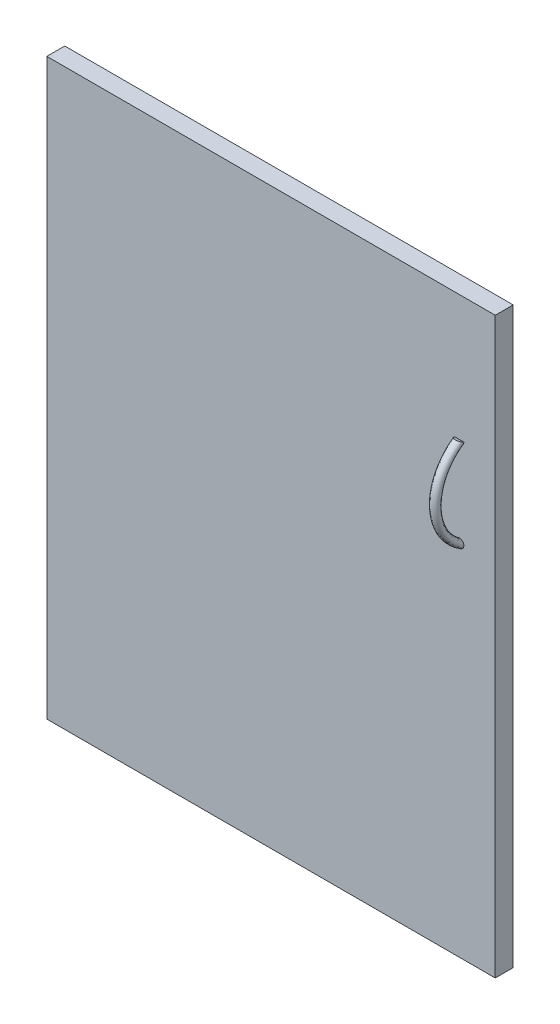
from build123d import *

# Parameters (mm, degrees)
SKETCH_1_W      = 25
SKETCH_1_H      = 32
EXTRUDE_1_DEPTH = 1
SKETCH_3_R      = 0.25


with BuildPart() as part:
    # 草圖1 → 填料-伸長1 (new body)
    with BuildSketch(Plane.XY):
        Rectangle(SKETCH_1_W, SKETCH_1_H)
    extrude(amount=EXTRUDE_1_DEPTH)

    # 掃出1: sweep along a path in 草圖4
    with BuildLine(Plane(origin=(10.5, 0, 0), x_dir=(0, 0, -1), z_dir=(1, 0, 0))) as sweep_1_path:
        ThreePointArc((-1, 4), (-2.341687605, 6.5), (-1, 9))
    # 草圖3 → 掃出1 (sweep)
    with BuildSketch(Plane.XY.offset(1)):
        with Locations((10.5, 4)):
            Circle(SKETCH_3_R)
    sweep(path=sweep_1_path.line)


solid = part.part
